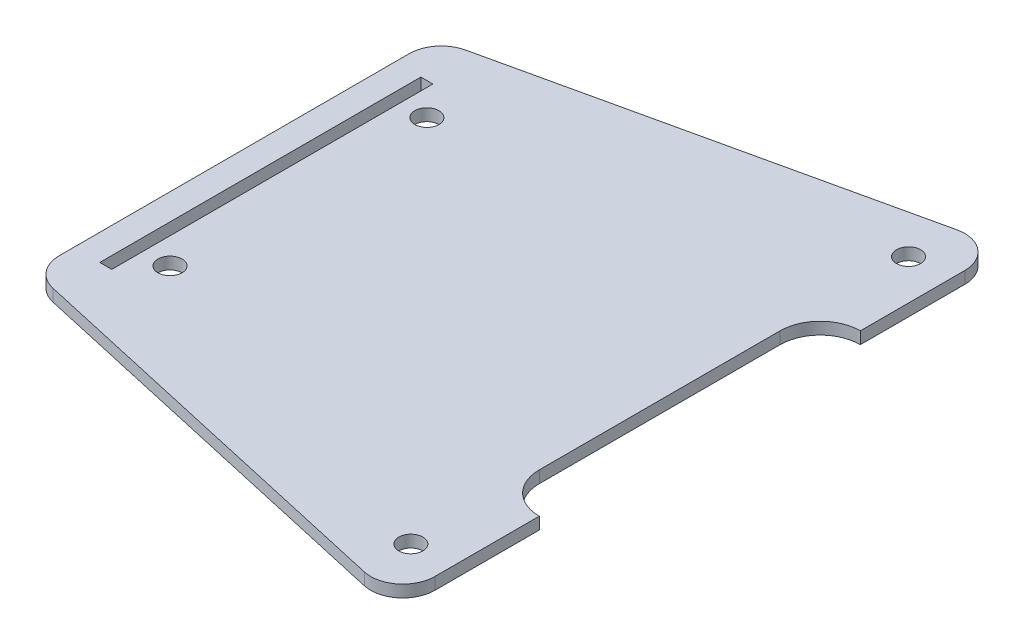
from build123d import *

# Parameters (mm, degrees)
SKETCH_1_R          = 1.5
SKETCH_1_W          = 1.5
SKETCH_1_H          = 40
EXTRUDE_1_DEPTH     = 1.5
CUT_EXTRUDE_2_DEPTH = 51.351266121
FILLET_1_R          = 4


with BuildPart() as part:
    # 草图1 → 凸台-拉伸1 (new body)
    with BuildSketch(Plane(origin=(0, 0, 0), x_dir=(1, 0, 0), z_dir=(0, 1, 0))):
        Polygon((-33, 25), (-33, -25), (25, -38), (25, 38), align=None)
        with Locations(Location((-25, 16, 0), (0, 0, 270))):
            Circle(SKETCH_1_R, mode=Mode.SUBTRACT)
        with Locations(Location((20, 31, 0), (0, 0, 270))):
            Circle(SKETCH_1_R, mode=Mode.SUBTRACT)
        with Locations(Location((20, -31, 0), (0, 0, 90))):
            Circle(SKETCH_1_R, mode=Mode.SUBTRACT)
        with Locations(Location((-25, -16, 0), (0, 0, 90))):
            Circle(SKETCH_1_R, mode=Mode.SUBTRACT)
        with Locations((-29, 0)):
            Rectangle(SKETCH_1_W, SKETCH_1_H, mode=Mode.SUBTRACT)
    extrude(amount=EXTRUDE_1_DEPTH)

    # 草图3 → 切除-拉伸2 (cut, through all)
    with BuildSketch(Plane(origin=(0, 1.5, 0), x_dir=(1, 0, 0), z_dir=(0, 1, 0))):
        with BuildLine():
            Line((20, -15), (20, 15))
            ThreePointArc((20, 15), (25, 20), (30, 15))
            Line((30, 15), (30, -15))
            ThreePointArc((30, -15), (25, -20), (20, -15))
        make_face()
    extrude(amount=-CUT_EXTRUDE_2_DEPTH, mode=Mode.SUBTRACT)

    # 圆角1
    fillet_1_edges = [part.edges().sort_by_distance(p)[0] for p in [
        (25, 0.75, -38),
        (25, 0.75, 38),
        (-33, 0.75, 25),
        (-33, 0.75, -25),
    ]]
    fillet(fillet_1_edges, radius=FILLET_1_R)


solid = part.part
